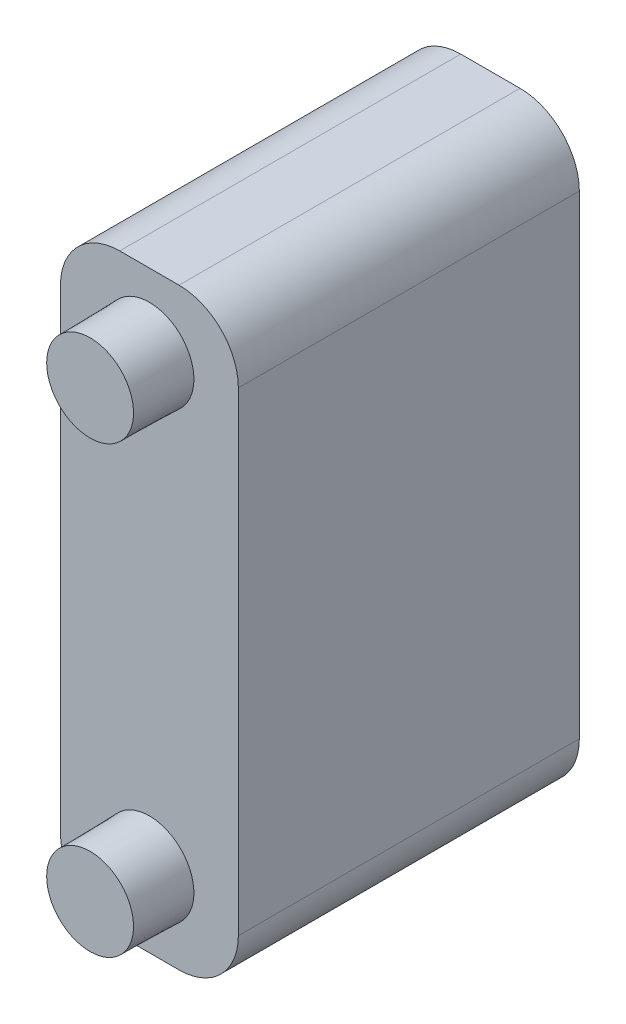
from build123d import *

# Parameters (mm, degrees)
BOSS_EXTRUDE1_DEPTH           = 11.5
BOSS_EXTRUDE2_START           = 11.5
SKETCH1_3_R                   = 1.5
BOSS_EXTRUDE2_DEPTH           = 2
BOSS_EXTRUDE2_DRAFT           = 1
BOSS_EXTRUDE2_PROFILE_2_DEPTH = 2
BOSS_EXTRUDE2_PROFILE_2_DRAFT = 1


with BuildPart() as part:
    # Sketch1 → Boss-Extrude1 (new body)
    with BuildSketch(Plane(origin=(0, 0, 0), x_dir=(0, 1, 0), z_dir=(0, 0, 1))):
        with BuildLine():
            Line((2, 0), (18, 0))
            ThreePointArc((18, 0), (19.414213562, 0.585786438), (20, 2))
            Line((20, 2), (20, 4))
            ThreePointArc((20, 4), (19.414213562, 5.414213562), (18, 6))
            Line((18, 6), (2, 6))
            ThreePointArc((2, 6), (0.585786438, 5.414213562), (0, 4))
            Line((0, 4), (0, 2))
            ThreePointArc((0, 2), (0.585786438, 0.585786438), (2, 0))
        make_face()
    extrude(amount=BOSS_EXTRUDE1_DEPTH)


with BuildPart() as boss_extrude2_tool:
    # Sketch1<3> → Boss-Extrude2 (with draft: the straight prism first)
    with BuildSketch(Plane(origin=(0, 0, 0), x_dir=(0, 1, 0), z_dir=(0, 0, 1)).offset(BOSS_EXTRUDE2_START)):
        with Locations((2.5, 3)):
            Circle(SKETCH1_3_R)
    extrude(amount=BOSS_EXTRUDE2_DEPTH)
    # Boss-Extrude2: the draft: its side faces are tilted about the plane it starts from
    boss_extrude2_sides = [boss_extrude2_tool.faces().sort_by_distance(p)[0] for p in [
        (-3, 1, 12.5),
    ]]
    draft(boss_extrude2_sides, Plane(origin=(0, 0, 0), x_dir=(0, 1, 0), z_dir=(0, 0, 1)).offset(BOSS_EXTRUDE2_START), BOSS_EXTRUDE2_DRAFT)


with BuildPart() as part_1:
    add(part.part)

    # Boss-Extrude2: add boss_extrude2_tool
    add(boss_extrude2_tool.part)


with BuildPart() as boss_extrude2_profile_2_tool:
    # Sketch1<3> → Boss-Extrude2 profile 2 (with draft: the straight prism first)
    with BuildSketch(Plane(origin=(0, 0, 0), x_dir=(0, 1, 0), z_dir=(0, 0, 1)).offset(BOSS_EXTRUDE2_START)):
        with Locations((17.5, 3)):
            Circle(SKETCH1_3_R)
    extrude(amount=BOSS_EXTRUDE2_PROFILE_2_DEPTH)
    # Boss-Extrude2 profile 2: the draft: its side faces are tilted about the plane it starts from
    boss_extrude2_profile_2_sides = [boss_extrude2_profile_2_tool.faces().sort_by_distance(p)[0] for p in [
        (-3, 16, 12.5),
    ]]
    draft(boss_extrude2_profile_2_sides, Plane(origin=(0, 0, 0), x_dir=(0, 1, 0), z_dir=(0, 0, 1)).offset(BOSS_EXTRUDE2_START), BOSS_EXTRUDE2_PROFILE_2_DRAFT)


with BuildPart() as part_2:
    add(part_1.part)

    # Boss-Extrude2 profile 2: add boss_extrude2_profile_2_tool
    add(boss_extrude2_profile_2_tool.part)


solid = part_2.part
